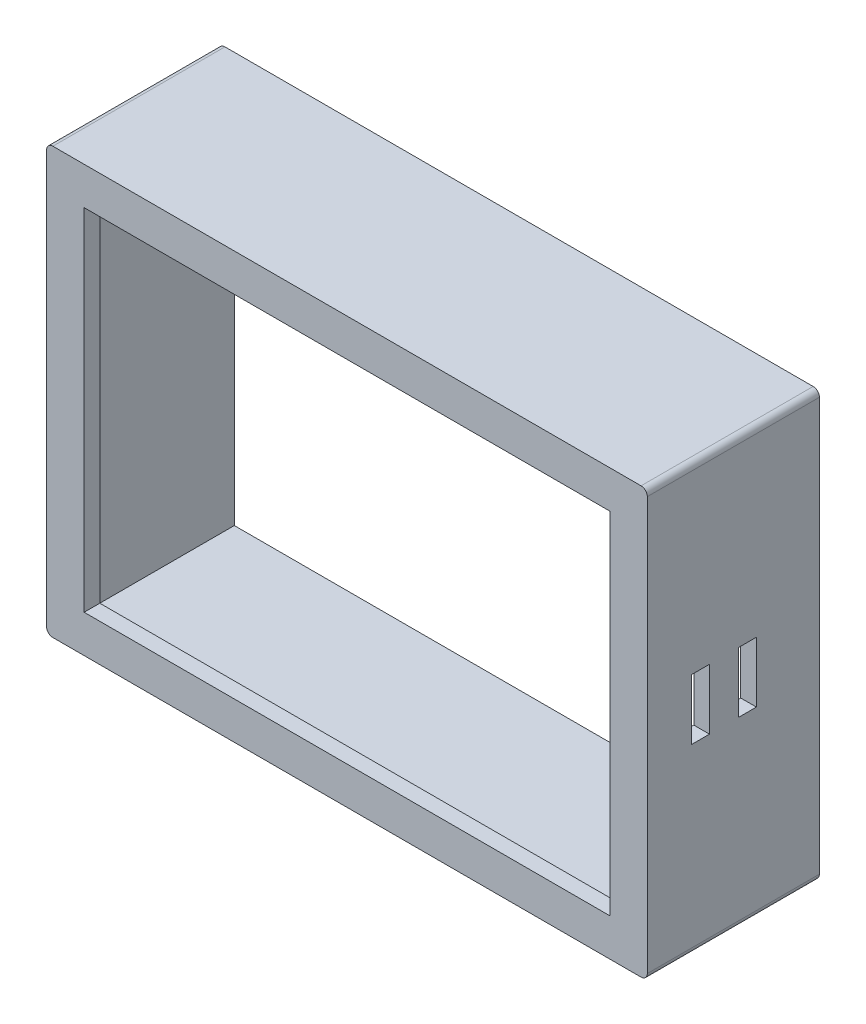
from build123d import *

# Parameters (mm, degrees)
SKETCH1_W           = 96
SKETCH1_H           = 68
SKETCH1_W_2         = 84
SKETCH1_H_2         = 56
BOSS_EXTRUDE1_DEPTH = 2.5
SKETCH2_W           = 96
SKETCH2_H           = 68
SKETCH2_W_2         = 91
SKETCH2_H_2         = 63
BOSS_EXTRUDE2_DEPTH = 25
FILLET1_R           = 1
SKETCH3_W           = 2.865098433
SKETCH3_H           = 9.669707212
CUT_EXTRUDE1_DEPTH  = 2.5


with BuildPart() as part:
    # Sketch1 → Boss-Extrude1 (new body)
    with BuildSketch(Plane.XY):
        Rectangle(SKETCH1_W, SKETCH1_H)
        Rectangle(SKETCH1_W_2, SKETCH1_H_2, mode=Mode.SUBTRACT)
    extrude(amount=-BOSS_EXTRUDE1_DEPTH)

    # Sketch2 → Boss-Extrude2 (add)
    with BuildSketch(Plane(origin=(0, 0, -2.5), x_dir=(-1, 0, 0), z_dir=(0, 0, -1))):
        Rectangle(SKETCH2_W, SKETCH2_H)
        Rectangle(SKETCH2_W_2, SKETCH2_H_2, mode=Mode.SUBTRACT)
    extrude(amount=BOSS_EXTRUDE2_DEPTH)

    # Fillet1
    fillet1_edges = [part.edges().sort_by_distance(p)[0] for p in [
        (-48, 34, -13.75),
        (48, 34, -13.75),
        (48, -34, -13.75),
        (-48, -34, -13.75),
    ]]
    fillet(fillet1_edges, radius=FILLET1_R)

    # Sketch3 → Cut-Extrude1 (cut)
    with BuildSketch(Plane(origin=(48, 0, 0), x_dir=(0, 0, -1), z_dir=(1, 0, 0))):
        with Locations((15.997319539, 0)):
            Rectangle(SKETCH3_W, SKETCH3_H)
        with Locations((8.497319539, 0)):
            Rectangle(SKETCH3_W, SKETCH3_H)
    extrude(amount=-CUT_EXTRUDE1_DEPTH, mode=Mode.SUBTRACT)


solid = part.part
